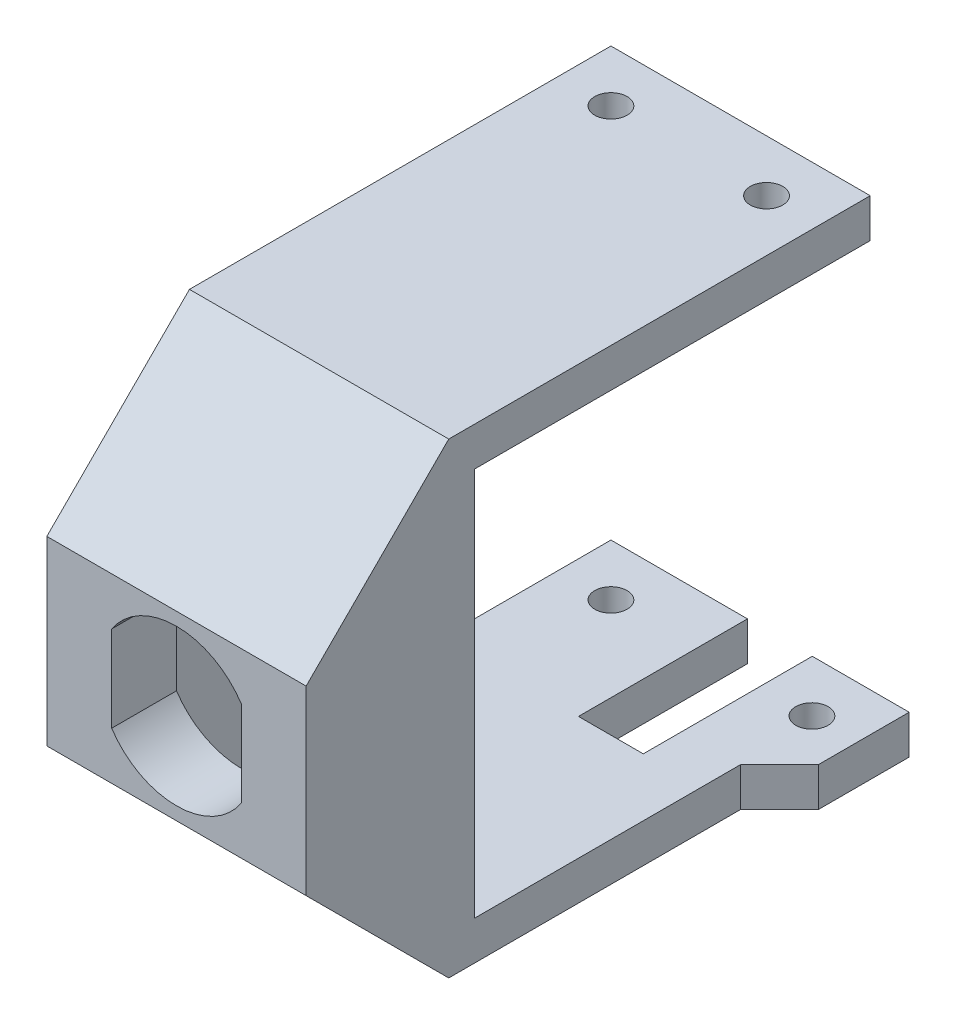
from build123d import *

# Parameters (mm, degrees)
SKETCH_2_W          = 20
SKETCH_2_H          = 30
EXTRUDE_1_DEPTH     = 5
SKETCH_5_W          = 20
SKETCH_5_H          = 3
EXTRUDE_3_DEPTH     = 43.51
CUT_EXTRUDE_2_REACH = 125.027
SKETCH_6_W          = 5
SKETCH_6_H          = 13.035
EXTRUDE_4_DEPTH     = 3
CUT_EXTRUDE_3_REACH = 127.702
SKETCH_8_R          = 1.25
CUT_EXTRUDE_4_REACH = 127.702
SKETCH_9_R          = 1.25
CHAMFER_2_SIZE      = 8
CHAMFER_3_SIZE      = 11
EXTRUDE_6_DEPTH     = 3


with BuildPart() as part:
    # 草图2 → 凸台-拉伸1 (new body)
    with BuildSketch(Plane.XY.offset(38.51)):
        with Locations((99.3, 0)):
            Rectangle(SKETCH_2_W, SKETCH_2_H)
        with BuildLine():
            Line((104.3, -3.31662479), (104.3, 3.31662479))
            ThreePointArc((104.3, 3.31662479), (99.3, 6), (94.3, 3.31662479))
            Line((94.3, 3.31662479), (94.3, -3.31662479))
            ThreePointArc((94.3, -3.31662479), (99.3, -6), (104.3, -3.31662479))
        make_face(mode=Mode.SUBTRACT)
    extrude(amount=EXTRUDE_1_DEPTH)

    # 草图5 → 凸台-拉伸3 (add)
    with BuildSketch(Plane.XY.offset(43.51)):
        with Locations((99.3, 16.5)):
            Rectangle(SKETCH_5_W, SKETCH_5_H)
        with Locations((99.3, -16.5)):
            Rectangle(SKETCH_5_W, SKETCH_5_H)
    extrude(amount=-EXTRUDE_3_DEPTH)

    # 草图6 → 切除-拉伸2 (cut, up to next)
    with BuildSketch(Plane.XZ.offset(18), mode=Mode.PRIVATE) as cut_extrude_2_sk1:
        with Locations((102.329663749, 6.5175)):
            Rectangle(SKETCH_6_W, SKETCH_6_H)
    cut_extrude_2_tool1 = extrude(cut_extrude_2_sk1.sketch, amount=-CUT_EXTRUDE_2_REACH, mode=Mode.PRIVATE) & part.part
    add(cut_extrude_2_tool1.solids().sort_by_distance((102.329664, -18, 6.5175))[0], mode=Mode.SUBTRACT)

    # 草图7 → 凸台-拉伸4 (add)
    with BuildSketch(Plane.XZ.offset(18)):
        Polygon((109.3, 10), (112.302663002, 6.997336998), (112.302663002, 0), (109.3, 0), align=None)
    extrude(amount=-EXTRUDE_4_DEPTH)

    # 草图8 → 切除-拉伸3 (cut, up to next)
    with BuildSketch(Plane.XZ.offset(18), mode=Mode.PRIVATE) as cut_extrude_3_sk1:
        with Locations(Location((93.3, 4, 0), (0, 0, 270))):
            Circle(SKETCH_8_R)
    cut_extrude_3_tool1 = extrude(cut_extrude_3_sk1.sketch, amount=-CUT_EXTRUDE_3_REACH, mode=Mode.PRIVATE) & part.part
    # 草图8 → 切除-拉伸3 (cut, up to next)
    with BuildSketch(Plane.XZ.offset(18), mode=Mode.PRIVATE) as cut_extrude_3_sk2:
        with Locations(Location((108.802663002, 4, 0), (0, 0, 270))):
            Circle(SKETCH_8_R)
    cut_extrude_3_tool2 = extrude(cut_extrude_3_sk2.sketch, amount=-CUT_EXTRUDE_3_REACH, mode=Mode.PRIVATE) & part.part
    add(cut_extrude_3_tool1.solids().sort_by_distance((93.3, -18, 4))[0], mode=Mode.SUBTRACT)
    add(cut_extrude_3_tool2.solids().sort_by_distance((108.802663, -18, 4))[0], mode=Mode.SUBTRACT)

    # 草图9 → 切除-拉伸4 (cut, up to next)
    with BuildSketch(Plane(origin=(0, 18, 0), x_dir=(1, 0, 0), z_dir=(0, 1, 0)), mode=Mode.PRIVATE) as cut_extrude_4_sk1:
        with Locations(Location((105.3, -4, 0), (0, 0, 270))):
            Circle(SKETCH_9_R)
    cut_extrude_4_tool1 = extrude(cut_extrude_4_sk1.sketch, amount=-CUT_EXTRUDE_4_REACH, mode=Mode.PRIVATE) & part.part
    # 草图9 → 切除-拉伸4 (cut, up to next)
    with BuildSketch(Plane(origin=(0, 18, 0), x_dir=(1, 0, 0), z_dir=(0, 1, 0)), mode=Mode.PRIVATE) as cut_extrude_4_sk2:
        with Locations(Location((93.3, -4, 0), (0, 0, 90))):
            Circle(SKETCH_9_R)
    cut_extrude_4_tool2 = extrude(cut_extrude_4_sk2.sketch, amount=-CUT_EXTRUDE_4_REACH, mode=Mode.PRIVATE) & part.part
    add(cut_extrude_4_tool1.solids().sort_by_distance((105.3, 18, 4))[0], mode=Mode.SUBTRACT)
    add(cut_extrude_4_tool2.solids().sort_by_distance((93.3, 18, 4))[0], mode=Mode.SUBTRACT)

    # 倒角2
    chamfer_2_edges = [part.edges().sort_by_distance(p)[0] for p in [
        (99.3, -15, 38.51),
        (99.3, 15, 38.51),
    ]]
    chamfer(chamfer_2_edges, length=CHAMFER_2_SIZE)

    # 倒角3
    chamfer_3_edges = [part.edges().sort_by_distance(p)[0] for p in [
        (99.3, 18, 43.51),
        (99.3, -18, 43.51),
    ]]
    chamfer(chamfer_3_edges, length=CHAMFER_3_SIZE)

    # 草图14 → 凸台-拉伸6 (add)
    with BuildSketch(Plane.ZY.offset(-89.3)):
        Polygon((38.51, -7), (30.51, -15), (30.51, 15), (38.51, 7), align=None)
    extrude_6 = extrude(amount=-EXTRUDE_6_DEPTH)

    # 镜向1: 凸台-拉伸6 across plane
    add(extrude_6.mirror(Plane(origin=(99.3, 0, 0), x_dir=(0, 0, 1), z_dir=(1, 0, 0))))


solid = part.part
